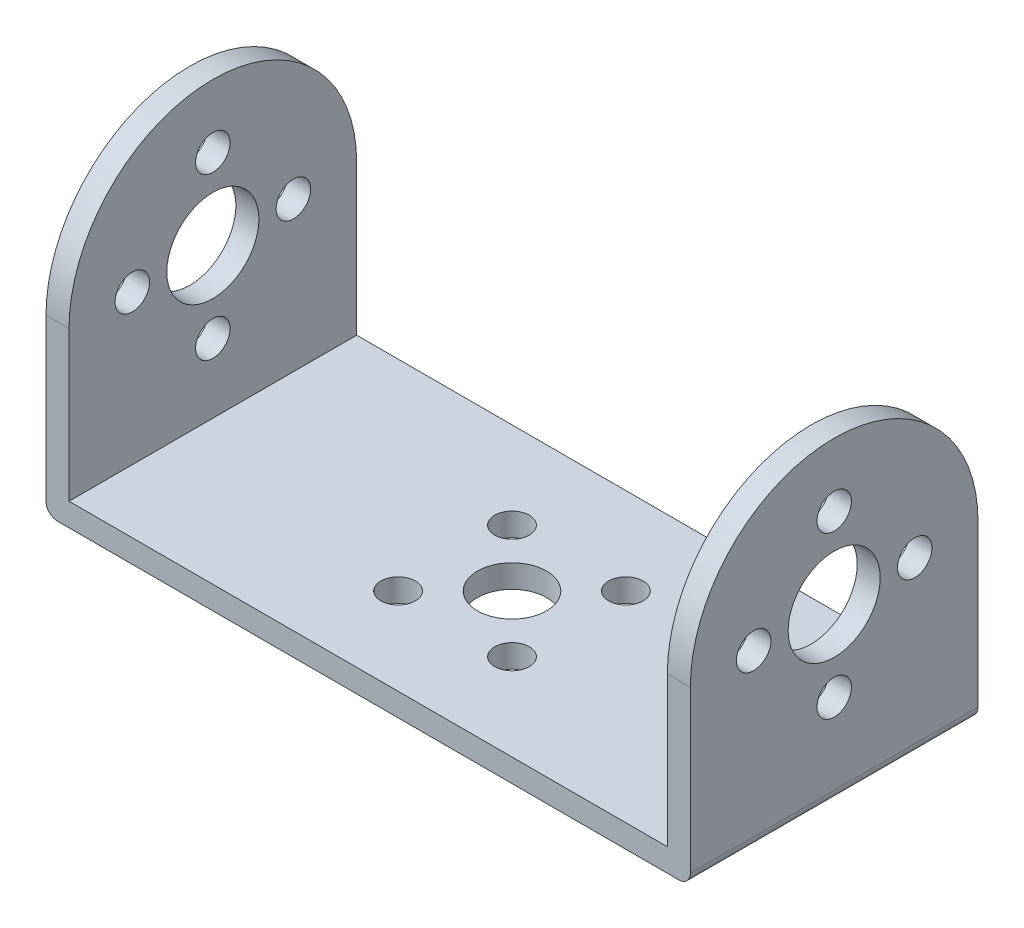
from build123d import *

# Parameters (mm, degrees)
SKETCH_1_W          = 56
SKETCH_1_H          = 25
EXTRUDE_1_DEPTH     = 2
SKETCH_2_R          = 3
SKETCH_2_R_2        = 1.5
CUT_EXTRUDE_1_DEPTH = 39.082744359
EXTRUDE_2_DEPTH     = 2
CUT_EXTRUDE_2_REACH = 65.776
SKETCH_4_R          = 4
SKETCH_4_R_2        = 1.5
FILLET_1_R          = 1


with BuildPart() as part:
    # 草图1 → 凸台-拉伸1 (new body)
    with BuildSketch(Plane(origin=(0, 0, 0), x_dir=(1, 0, 0), z_dir=(0, 1, 0))):
        with Locations((7.654255319, 0.731382979)):
            Rectangle(SKETCH_1_W, SKETCH_1_H)
    extrude(amount=EXTRUDE_1_DEPTH)

    # 草图2 → 切除-拉伸1 (cut, through all)
    with BuildSketch(Plane(origin=(0, 2, 0), x_dir=(1, 0, 0), z_dir=(0, 1, 0))):
        with Locations(Location((7.654255319, 0.731382979, 0), (0, 0, 270))):
            Circle(SKETCH_2_R)
        with Locations(Location((12.604002787, 5.681130447, 0), (0, 0, 270))):
            Circle(SKETCH_2_R_2)
        with Locations(Location((2.704507851, 5.681130447, 0), (0, 0, 270))):
            Circle(SKETCH_2_R_2)
        with Locations(Location((12.604002787, -4.21836449, 0), (0, 0, 270))):
            Circle(SKETCH_2_R_2)
        with Locations(Location((2.704507851, -4.21836449, 0), (0, 0, 270))):
            Circle(SKETCH_2_R_2)
    extrude(amount=-CUT_EXTRUDE_1_DEPTH, mode=Mode.SUBTRACT)

    # 草图3 → 凸台-拉伸2 (add)
    with BuildSketch(Plane.ZY.offset(20.345744681)):
        with BuildLine():
            Line((-13.231382979, 15), (-13.231382979, 2))
            Line((-13.231382979, 2), (11.768617021, 2))
            Line((11.768617021, 2), (11.768617021, 15))
            ThreePointArc((11.768617021, 15), (-0.731382979, 27.5), (-13.231382979, 15))
        make_face()
    extrude_2 = extrude(amount=-EXTRUDE_2_DEPTH)

    # 草图4 → 切除-拉伸2 (cut, up to next)
    with BuildSketch(Plane.ZY.offset(20.345744681), mode=Mode.PRIVATE) as cut_extrude_2_sk1:
        with Locations((-0.731382979, 15)):
            Circle(SKETCH_4_R)
    cut_extrude_2_tool1 = extrude(cut_extrude_2_sk1.sketch, amount=-CUT_EXTRUDE_2_REACH, mode=Mode.PRIVATE) & part.part
    # 草图4 → 切除-拉伸2 (cut, up to next)
    with BuildSketch(Plane.ZY.offset(20.345744681), mode=Mode.PRIVATE) as cut_extrude_2_sk2:
        with Locations((-0.731382979, 22)):
            Circle(SKETCH_4_R_2)
    cut_extrude_2_tool2 = extrude(cut_extrude_2_sk2.sketch, amount=-CUT_EXTRUDE_2_REACH, mode=Mode.PRIVATE) & part.part
    # 草图4 → 切除-拉伸2 (cut, up to next)
    with BuildSketch(Plane.ZY.offset(20.345744681), mode=Mode.PRIVATE) as cut_extrude_2_sk3:
        with Locations((6.268617021, 15)):
            Circle(SKETCH_4_R_2)
    cut_extrude_2_tool3 = extrude(cut_extrude_2_sk3.sketch, amount=-CUT_EXTRUDE_2_REACH, mode=Mode.PRIVATE) & part.part
    # 草图4 → 切除-拉伸2 (cut, up to next)
    with BuildSketch(Plane.ZY.offset(20.345744681), mode=Mode.PRIVATE) as cut_extrude_2_sk4:
        with Locations((-0.731382979, 8)):
            Circle(SKETCH_4_R_2)
    cut_extrude_2_tool4 = extrude(cut_extrude_2_sk4.sketch, amount=-CUT_EXTRUDE_2_REACH, mode=Mode.PRIVATE) & part.part
    # 草图4 → 切除-拉伸2 (cut, up to next)
    with BuildSketch(Plane.ZY.offset(20.345744681), mode=Mode.PRIVATE) as cut_extrude_2_sk5:
        with Locations((-7.731382979, 15)):
            Circle(SKETCH_4_R_2)
    cut_extrude_2_tool5 = extrude(cut_extrude_2_sk5.sketch, amount=-CUT_EXTRUDE_2_REACH, mode=Mode.PRIVATE) & part.part
    cut_extrude_2_1 = cut_extrude_2_tool1.solids().sort_by_distance((-20.345745, 15, -0.731383))[0]
    add(cut_extrude_2_1, mode=Mode.SUBTRACT)
    cut_extrude_2_2 = cut_extrude_2_tool2.solids().sort_by_distance((-20.345745, 22, -0.731383))[0]
    add(cut_extrude_2_2, mode=Mode.SUBTRACT)
    cut_extrude_2_3 = cut_extrude_2_tool3.solids().sort_by_distance((-20.345745, 15, 6.268617))[0]
    add(cut_extrude_2_3, mode=Mode.SUBTRACT)
    cut_extrude_2_4 = cut_extrude_2_tool4.solids().sort_by_distance((-20.345745, 8, -0.731383))[0]
    add(cut_extrude_2_4, mode=Mode.SUBTRACT)
    cut_extrude_2_5 = cut_extrude_2_tool5.solids().sort_by_distance((-20.345745, 15, -7.731383))[0]
    add(cut_extrude_2_5, mode=Mode.SUBTRACT)
    cut_extrude_2 = cut_extrude_2_1 + cut_extrude_2_2 + cut_extrude_2_3 + cut_extrude_2_4 + cut_extrude_2_5  # 切除-拉伸2 as one shape, for the pattern or mirror that repeats it

    # 镜向1: 凸台-拉伸2, 切除-拉伸2 across plane
    add(extrude_2.mirror(Plane.ZY.offset(-7.654255319)))
    add(cut_extrude_2.mirror(Plane.ZY.offset(-7.654255319)), mode=Mode.SUBTRACT)

    # 圆角1
    fillet_1_edges = [part.edges().sort_by_distance(p)[0] for p in [
        (35.654255319, 0, -0.731382979),
        (-20.345744681, 0, -0.731382979),
    ]]
    fillet(fillet_1_edges, radius=FILLET_1_R)


solid = part.part
